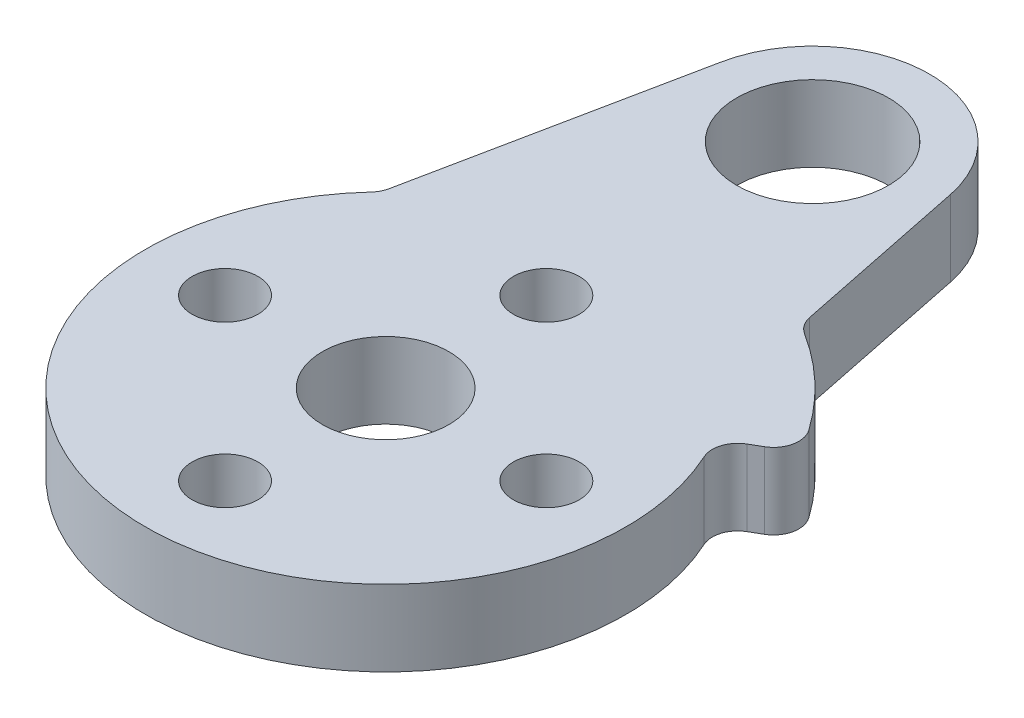
from build123d import *

# Parameters (mm, degrees)
SKETCH1_R           = 3
SKETCH1_R_2         = 2.5
BOSS_EXTRUDE1_DEPTH = 3
SKETCH2_R           = 1.3
CUT_EXTRUDE1_DEPTH  = 3
BOSS_EXTRUDE2_START = -3
BOSS_EXTRUDE2_DEPTH = 3
BOSS_EXTRUDE3_START = -3
BOSS_EXTRUDE3_DEPTH = 3
FILLET1_R           = 1


with BuildPart() as part:
    # Sketch1 → Boss-Extrude1 (new body)
    with BuildSketch(Plane(origin=(0, 0, 0), x_dir=(1, 0, 0), z_dir=(0, 1, 0))):
        with BuildLine():
            Line((-4.531642246, 17.7995776), (-7.838367177, 1.6))
            ThreePointArc((-7.838367177, 1.6), (0, -8), (7.838367177, 1.6))
            Line((7.838367177, 1.6), (4.531642246, 17.7995776))
            ThreePointArc((4.531642246, 17.7995776), (0, 21.499648), (-4.531642246, 17.7995776))
        make_face()
        with Locations(Location((0, 16.87456, 0), (0, 0, 270))):
            Circle(SKETCH1_R, mode=Mode.SUBTRACT)
        with Locations(Location((0, 0, 0), (0, 0, 270))):
            Circle(SKETCH1_R_2, mode=Mode.SUBTRACT)
    extrude(amount=BOSS_EXTRUDE1_DEPTH)

    # Sketch2 → Cut-Extrude1 (cut)
    with BuildSketch(Plane(origin=(0, 3, 0), x_dir=(1, 0, 0), z_dir=(0, 1, 0))):
        with Locations(Location((0, 6.35, 0), (0, 0, 270))):
            Circle(SKETCH2_R)
        with Locations(Location((6.35, 0, 0), (0, 0, 270))):
            Circle(SKETCH2_R)
        with Locations(Location((0, -6.35, 0), (0, 0, 270))):
            Circle(SKETCH2_R)
        with Locations(Location((-6.35, 0, 0), (0, 0, 270))):
            Circle(SKETCH2_R)
    extrude(amount=-CUT_EXTRUDE1_DEPTH, mode=Mode.SUBTRACT)

    # Sketch3 → Boss-Extrude2 (add)
    with BuildSketch(Plane(origin=(0, 3, 0), x_dir=(1, 0, 0), z_dir=(0, 1, 0)).offset(BOSS_EXTRUDE2_START)):
        with BuildLine():
            Line((-7.838367177, 1.6), (-6.8136721, 6.619960159))
            ThreePointArc((-6.8136721, 6.619960159), (0, -9.5), (6.8136721, 6.619960159))
            Line((6.8136721, 6.619960159), (7.838367177, 1.6))
            ThreePointArc((7.838367177, 1.6), (0, -8), (-7.838367177, 1.6))
        make_face()
    extrude(amount=BOSS_EXTRUDE2_DEPTH)

    # Sketch4 → Boss-Extrude3 (add)
    with BuildSketch(Plane(origin=(0, 3, 0), x_dir=(1, 0, 0), z_dir=(0, 1, 0)).offset(BOSS_EXTRUDE3_START)):
        with BuildLine():
            Line((8.227241336, 4.75), (10.392304845, 6))
            ThreePointArc((10.392304845, 6), (6, 10.392304845), (0, 12))
            Line((0, 12), (0, 9.5))
            ThreePointArc((0, 9.5), (4.75, 8.227241336), (8.227241336, 4.75))
        make_face()
    extrude(amount=BOSS_EXTRUDE3_DEPTH)

    # Fillet1
    fillet1_edges = [part.edges().sort_by_distance(p)[0] for p in [
        (-6.8136721, 1.5, -6.619960159),
        (6.049512795, 1.5, -10.36356092),
        (8.227241336, 1.5, -4.75),
        (10.392304845, 1.5, -6),
    ]]
    fillet(fillet1_edges, radius=FILLET1_R)


solid = part.part
